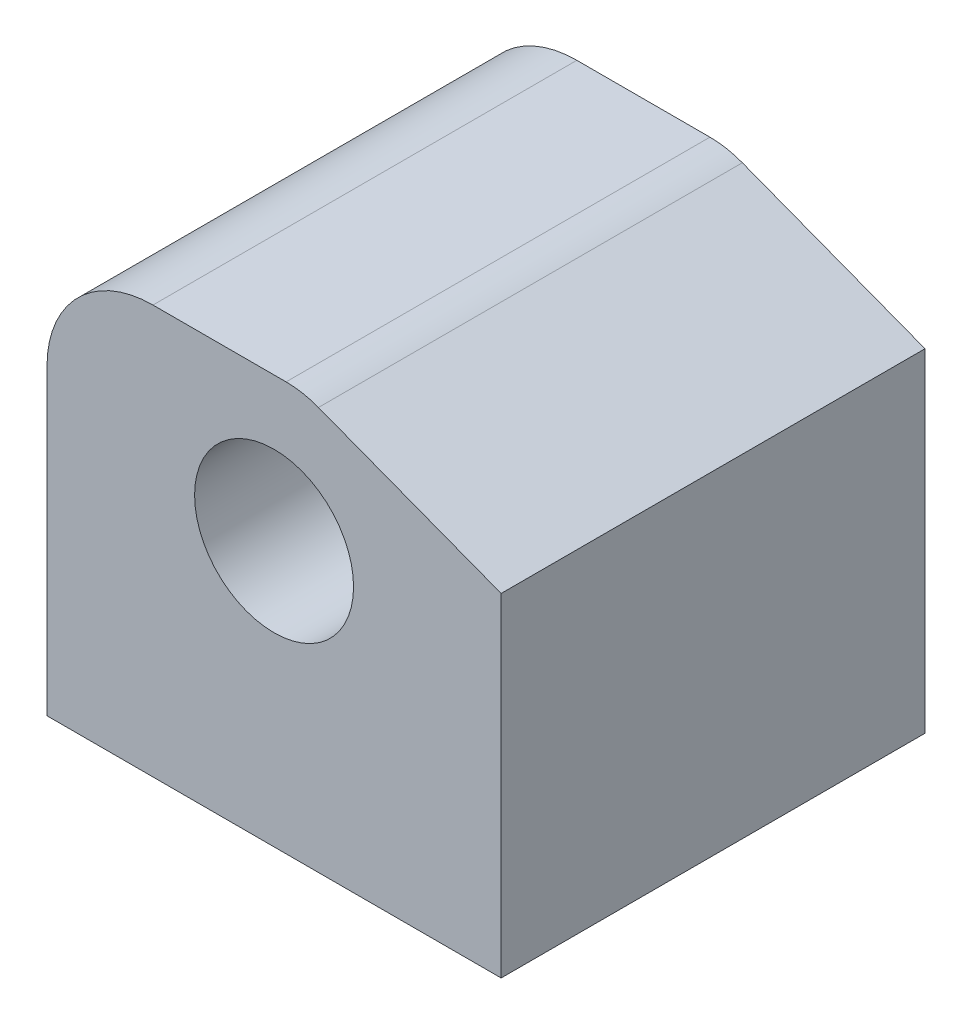
from build123d import *

# Parameters (mm, degrees)
SZKIC1_W                    = 15
SZKIC1_H                    = 14
DODANIE_WYCI_GNI_CIE1_DEPTH = 13.5
SZKIC2_R                    = 2.625
WYTNIJ_WYCI_GNI_CIE1_DEPTH  = 15
ZAOKR_GLENIE1_R             = 3.5
WYTNIJ_WYCI_GNI_CIE2_DEPTH  = 15
ZAOKR_GLENIE2_R             = 3
SZKIC4_R                    = 5.5
WYTNIJ_WYCI_GNI_CIE3_DEPTH  = 3


with BuildPart() as part:
    # Szkic1 → Dodanie-wyciągnięcie1 (new body)
    with BuildSketch(Plane(origin=(0, 0, 0), x_dir=(1, 0, 0), z_dir=(0, 1, 0))):
        Rectangle(SZKIC1_W, SZKIC1_H)
    extrude(amount=DODANIE_WYCI_GNI_CIE1_DEPTH)

    # Szkic2 → Wytnij-wyciągnięcie1 (cut)
    with BuildSketch(Plane.XY.offset(7)):
        with Locations((0, 8.75)):
            Circle(SZKIC2_R)
    extrude(amount=-WYTNIJ_WYCI_GNI_CIE1_DEPTH, mode=Mode.SUBTRACT)

    # Zaokrąglenie1
    zaokr_glenie1_edges = [part.edges().sort_by_distance(p)[0] for p in [
        (-7.5, 13.5, 0),
    ]]
    fillet(zaokr_glenie1_edges, radius=ZAOKR_GLENIE1_R)

    # Szkic3 → Wytnij-wyciągnięcie2 (cut)
    with BuildSketch(Plane.XY.offset(7)):
        Polygon((0.95, 13.5), (7.5, 11), (7.5, 13.5), align=None)
    extrude(amount=-WYTNIJ_WYCI_GNI_CIE2_DEPTH, mode=Mode.SUBTRACT)

    # Zaokrąglenie2
    zaokr_glenie2_edges = [part.edges().sort_by_distance(p)[0] for p in [
        (0.95, 13.5, 0),
    ]]
    fillet(zaokr_glenie2_edges, radius=ZAOKR_GLENIE2_R)

    # Szkic4 → Wytnij-wyciągnięcie3 (cut)
    with BuildSketch(Plane.XZ):
        with Locations(Location((0, 0, 0), (0, 0, 270))):
            Circle(SZKIC4_R)
    extrude(amount=-WYTNIJ_WYCI_GNI_CIE3_DEPTH, mode=Mode.SUBTRACT)


solid = part.part
